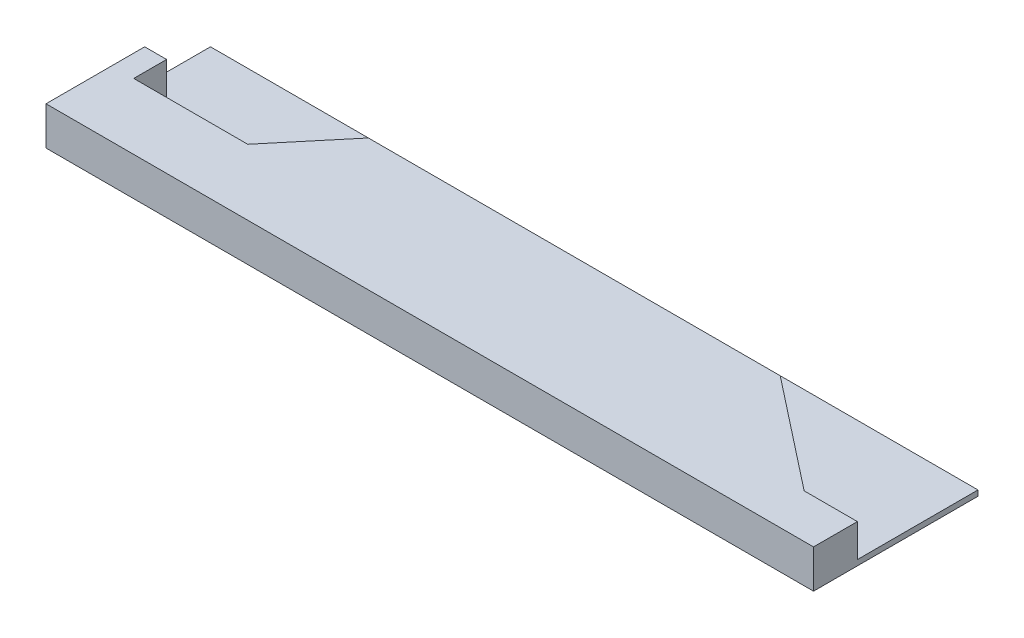
from build123d import *

# Parameters (mm, degrees)
BOSS_EXTRUDE1_DEPTH = 19.05
SKETCH2_R           = 3.96875
CUT_EXTRUDE1_DEPTH  = 19.05
SKETCH3_W           = 457.2
SKETCH3_H           = 152.4
BOSS_EXTRUDE3_DEPTH = 19.05
SKETCH4_W           = 457.2
SKETCH4_H           = 152.4
CUT_EXTRUDE2_DEPTH  = 25.4
CUT_EXTRUDE3_DEPTH  = 25.4
BOSS_EXTRUDE4_DEPTH = 3.175


with BuildPart() as part:
    # Sketch1 → Boss-Extrude1 (new body)
    with BuildSketch(Plane(origin=(0, 0, 0), x_dir=(1, 0, 0), z_dir=(0, 1, 0))):
        Polygon((57.15, 19.05), (0, 19.05), (0, 0), (66.037825848, 0), (97.808358016, 38.1), (336.311308439, 38.1), (400.965853894, -12.7), (431.8, -12.7), (342.9, 57.15), (88.9, 57.15), align=None)
    extrude(amount=BOSS_EXTRUDE1_DEPTH)

    # Sketch2 → Cut-Extrude1 (cut)
    with BuildSketch(Plane.XY):
        with Locations((8.89, 9.525)):
            Circle(SKETCH2_R)
        with Locations((56.515, 9.525)):
            Circle(SKETCH2_R)
    extrude(amount=-CUT_EXTRUDE1_DEPTH, mode=Mode.SUBTRACT)

    # Sketch4 → Cut-Extrude2 (cut)
    with BuildSketch(Plane(origin=(0, 0, 0), x_dir=(1, 0, 0), z_dir=(0, 1, 0))):
        with Locations((215.9, 38.1)):
            Rectangle(SKETCH4_W, SKETCH4_H)
    extrude(amount=CUT_EXTRUDE2_DEPTH, mode=Mode.SUBTRACT)


with BuildPart() as body_2:
    # Sketch3 → Boss-Extrude3 (new body)
    with BuildSketch(Plane.XZ):
        with Locations((215.9, -38.1)):
            Rectangle(SKETCH3_W, SKETCH3_H)
        Polygon((400.965853894, 12.7), (431.8, 12.7), (342.9, -57.15), (88.9, -57.15), (57.15, -19.05), (0, -19.05), (0, 0), (66.037825848, 0), (97.808358016, -38.1), (336.311308439, -38.1), align=None, mode=Mode.SUBTRACT)
    extrude(amount=BOSS_EXTRUDE3_DEPTH)

    # Sketch5 → Cut-Extrude3 (cut)
    with BuildSketch(Plane.XZ.offset(19.05)):
        Polygon((57.15, -19.05), (0, -19.05), (-12.7, -19.05), (-12.7, -114.3), (444.5, -114.3), (444.5, 38.1), (431.8, 38.1), (431.8, 12.7), (342.9, -57.15), (88.9, -57.15), align=None)
    extrude(amount=-CUT_EXTRUDE3_DEPTH, mode=Mode.SUBTRACT)

    # Sketch6 → Boss-Extrude4 (add)
    with BuildSketch(Plane.XZ.offset(19.05)):
        Polygon((400.965853894, 12.7), (336.311308439, -38.1), (336.311308439, -57.15), (431.8, -57.15), (431.8, 12.7), align=None)
        Polygon((336.311308439, -57.15), (336.311308439, -38.1), (97.808358016, -38.1), (66.037825848, 0), (0, 0), (0, -19.05), (-12.7, -19.05), (-12.7, -57.15), align=None)
        Polygon((97.808358016, -38.1), (336.311308439, -38.1), (336.311308439, 38.1), (-12.7, 38.1), (-12.7, -19.05), (0, -19.05), (0, 0), (66.037825848, 0), align=None)
        Polygon((336.311308439, 38.1), (336.311308439, -38.1), (400.965853894, 12.7), (431.8, 12.7), (431.8, 38.1), align=None)
    extrude(amount=BOSS_EXTRUDE4_DEPTH)


solid = body_2.part
